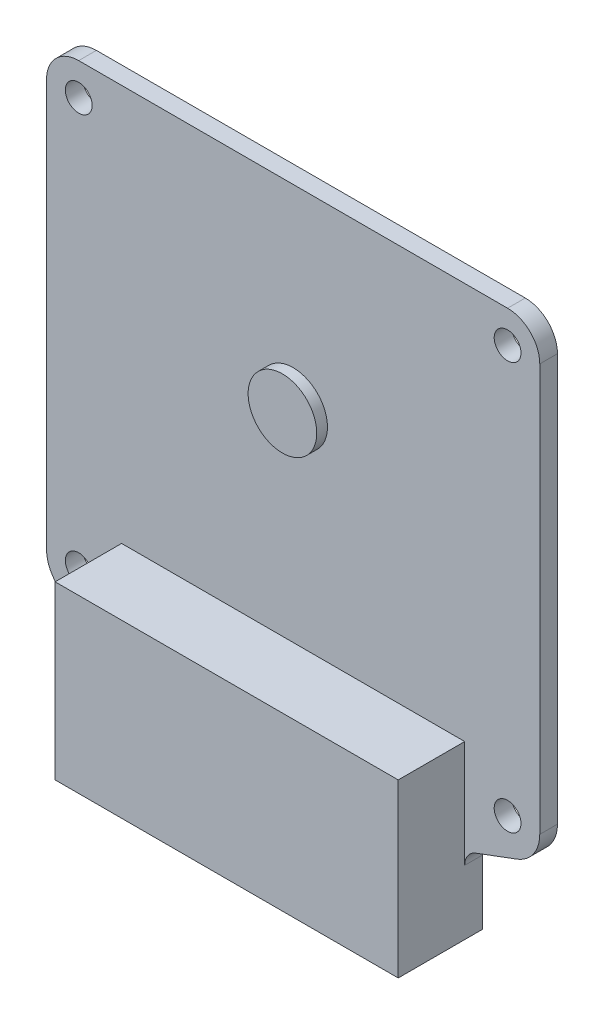
from build123d import *

# Parameters (mm, degrees)
SKETCH1_R           = 3.2
SKETCH1_R_2         = 1.25
BOSS_EXTRUDE1_DEPTH = 1.65
SKETCH2_W           = 32
SKETCH2_H           = 16
BOSS_EXTRUDE2_DEPTH = 6.2
SKETCH1_2_R         = 3.2
BOSS_EXTRUDE3_DEPTH = 2.65


with BuildPart() as part:
    # Sketch1 → Boss-Extrude1 (new body)
    with BuildSketch(Plane.XY):
        with BuildLine():
            Line((-20, 18), (20, 18))
            ThreePointArc((20, 18), (22.121320344, 17.121320344), (23, 15))
            Line((23, 15), (23, -23))
            ThreePointArc((23, -23), (22.416236427, -24.864680631), (20.873373788, -26.063592072))
            Line((20.873373788, -26.063592072), (17.047054496, -27.491625922))
            ThreePointArc((17.047054496, -27.491625922), (16.287418762, -28.081915652), (16, -29))
            Line((16, -29), (16, -35))
            Line((16, -35), (-16, -35))
            Line((-16, -35), (-16, -29))
            ThreePointArc((-16, -29), (-16.287418762, -28.081915652), (-17.047054496, -27.491625922))
            Line((-17.047054496, -27.491625922), (-20.873373788, -26.063592072))
            ThreePointArc((-20.873373788, -26.063592072), (-22.416236427, -24.864680631), (-23, -23))
            Line((-23, -23), (-23, 15))
            ThreePointArc((-23, 15), (-22.121320344, 17.121320344), (-20, 18))
        make_face()
        Circle(SKETCH1_R, mode=Mode.SUBTRACT)
        with Locations((20, 15)):
            Circle(SKETCH1_R_2, mode=Mode.SUBTRACT)
        with Locations((-20, 15)):
            Circle(SKETCH1_R_2, mode=Mode.SUBTRACT)
        with Locations((-20, -23)):
            Circle(SKETCH1_R_2, mode=Mode.SUBTRACT)
        with Locations((20, -23)):
            Circle(SKETCH1_R_2, mode=Mode.SUBTRACT)
    extrude(amount=BOSS_EXTRUDE1_DEPTH)

    # Sketch2 → Boss-Extrude2 (add)
    with BuildSketch(Plane.XY.offset(1.65)):
        with Locations((0, -27)):
            Rectangle(SKETCH2_W, SKETCH2_H)
    extrude(amount=BOSS_EXTRUDE2_DEPTH)

    # Sketch1<2> → Boss-Extrude3 (add)
    with BuildSketch(Plane.XY):
        Circle(SKETCH1_2_R)
    extrude(amount=BOSS_EXTRUDE3_DEPTH)


solid = part.part
